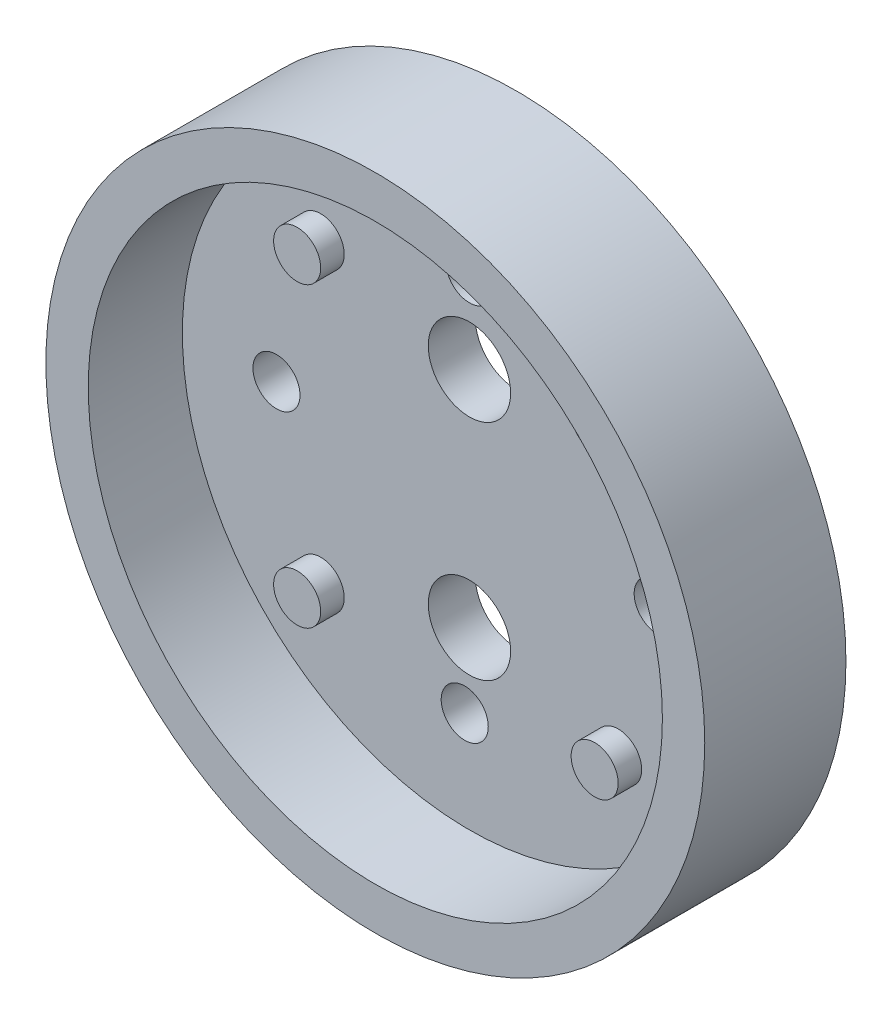
from build123d import *

# Parameters (mm, degrees)
SKETCH1_R           = 14
BOSS_EXTRUDE1_DEPTH = 2
SKETCH2_R           = 14
SKETCH2_R_2         = 12.2
BOSS_EXTRUDE2_DEPTH = 4
SKETCH3_R           = 1
CUT_EXTRUDE1_DEPTH  = 21.199009877
SKETCH4_R           = 1.75
CUT_EXTRUDE2_DEPTH  = 21.199009877
SKETCH5_R           = 1
BOSS_EXTRUDE3_DEPTH = 1


with BuildPart() as part:
    # Sketch1 → Boss-Extrude1 (new body)
    with BuildSketch(Plane.XY):
        Circle(SKETCH1_R)
    extrude(amount=BOSS_EXTRUDE1_DEPTH)

    # Sketch2 → Boss-Extrude2 (add)
    with BuildSketch(Plane.XY.offset(2)):
        Circle(SKETCH2_R)
        Circle(SKETCH2_R_2, mode=Mode.SUBTRACT)
    extrude(amount=BOSS_EXTRUDE2_DEPTH)

    # Sketch3 → Cut-Extrude1 (cut, through all)
    with BuildSketch(Plane.XY.offset(2)):
        with Locations((0, 8.2)):
            Circle(SKETCH3_R)
        with Locations((8, 0)):
            Circle(SKETCH3_R)
        with Locations((-0.2, -8)):
            Circle(SKETCH3_R)
        with Locations((-8.2, 0.2)):
            Circle(SKETCH3_R)
    extrude(amount=-CUT_EXTRUDE1_DEPTH, mode=Mode.SUBTRACT)

    # Sketch4 → Cut-Extrude2 (cut, through all)
    with BuildSketch(Plane.XY.offset(2)):
        with Locations((0, 4.75)):
            Circle(SKETCH4_R)
        with Locations((0, -4.75)):
            Circle(SKETCH4_R)
    extrude(amount=-CUT_EXTRUDE2_DEPTH, mode=Mode.SUBTRACT)

    # Sketch5 → Boss-Extrude3 (add)
    with BuildSketch(Plane.XY.offset(2)):
        with Locations((-6.320770843, -6.320770843)):
            Circle(SKETCH5_R)
        with Locations((-6.320770843, 6.320770843)):
            Circle(SKETCH5_R)
        with Locations((6.320770843, 6.320770843)):
            Circle(SKETCH5_R)
        with Locations((6.320770843, -6.320770843)):
            Circle(SKETCH5_R)
    extrude(amount=BOSS_EXTRUDE3_DEPTH)


solid = part.part
